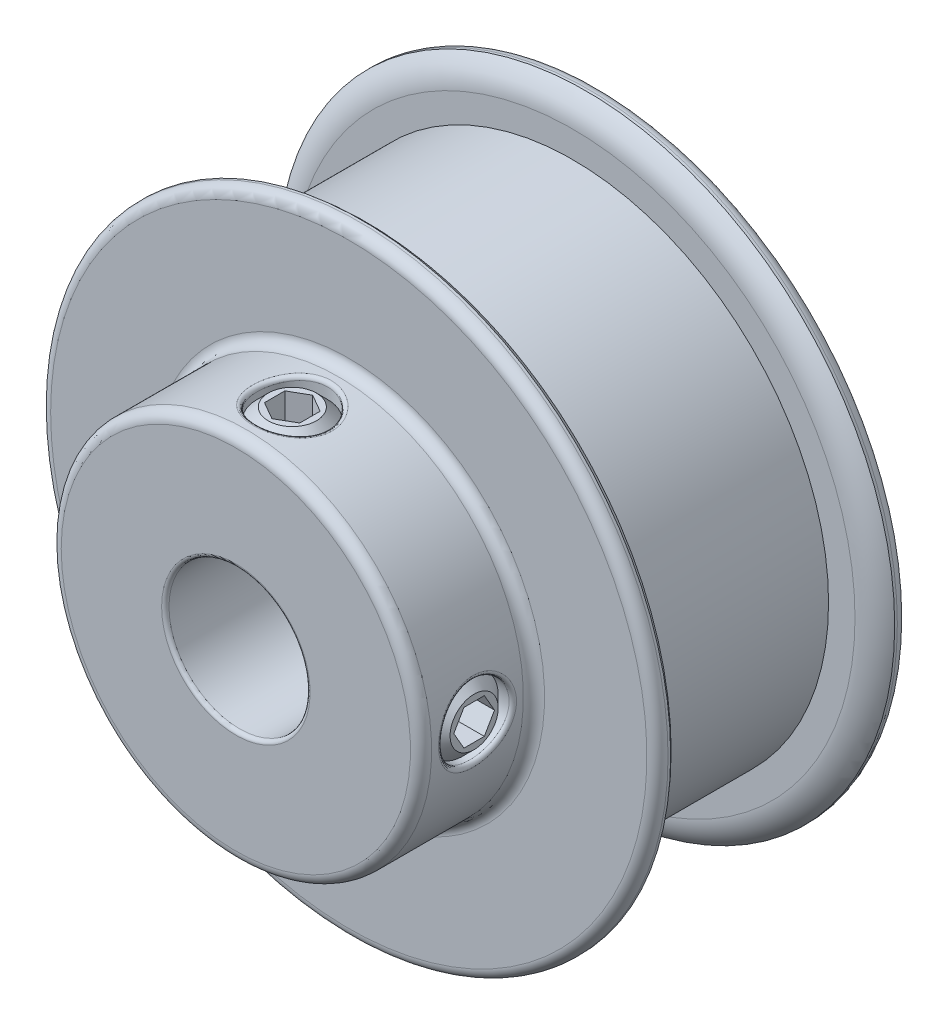
from build123d import *

# Parameters (mm, degrees)
SKETCH4_R          = 2
CUT_EXTRUDE2_DEPTH = 27.806529055
CUT_EXTRUDE3_DEPTH = 1.5
CIRPATTERN2_COUNT  = 2
CIRPATTERN2_ANGLE  = 90
FILLET1_R          = 0.6
FILLET2_R          = 0.21


with BuildPart() as part:
    # Sketch7 → Revolve1 (revolve)
    with BuildSketch(Plane(origin=(0, 0, 0), x_dir=(0, 0, -1), z_dir=(1, 0, 0)), mode=Mode.PRIVATE) as revolve1_sk:
        with BuildLine():
            Line((-10.3, 4), (-10.3, 10.5))
            Line((-10.3, 10.5), (-3.9, 10.5))
            Line((-3.9, 10.5), (-3.9, 17.5))
            Line((-3.9, 17.5), (-3.15, 17.5))
            ThreePointArc((-3.15, 17.5), (-2.597950392, 16.838586495), (-2.4, 16.000110356))
            Line((-2.4, 16.000110356), (-2.4, 14.500220711))
            Line((-2.4, 14.500220711), (8.8, 14.500220711))
            Line((8.8, 14.500220711), (8.8, 16.000110356))
            ThreePointArc((8.8, 16.000110356), (8.997950392, 16.838586495), (9.55, 17.5))
            Line((9.55, 17.5), (10.3, 17.5))
            Line((10.3, 17.5), (10.3, 4))
            Line((10.3, 4), (-10.3, 4))
        make_face()
    revolve(revolve1_sk.sketch.rotate(Axis((0, 0, 10.3), (0, 0, -1)), 90), axis=Axis((0, 0, 10.3), (0, 0, -1)))

    # Sketch4 → Cut-Extrude2 (cut, through all)
    with BuildSketch(Plane(origin=(0, 0, 0), x_dir=(1, 0, 0), z_dir=(0, 1, 0))):
        with Locations(Location((0, -7.1, 0), (0, 0, 90))):
            Circle(SKETCH4_R)
    cut_extrude2 = extrude(amount=CUT_EXTRUDE2_DEPTH, mode=Mode.SUBTRACT)

    # Sketch5 → Revolve2 (revolve)
    with BuildSketch(Plane.XY.offset(7.1), mode=Mode.PRIVATE) as revolve2_sk:
        Polygon((0, 10.307764064), (0, 4), (-1.365, 4), (-2, 4.635), (-2, 9.672764064), (-1.365, 10.307764064), align=None)
    revolve2 = revolve(revolve2_sk.sketch.rotate(Axis((0, 0, 7.1), (0, 1, 0)), 270), axis=Axis((0, 0, 7.1), (0, 1, 0)))

    # Sketch6 → Cut-Extrude3 (cut)
    with BuildSketch(Plane(origin=(0, 10.307764064, 0), x_dir=(-1, 0, 0), z_dir=(0, -1, 0))):
        Polygon((0, -5.945299462), (-1, -6.522649731), (-1, -7.677350269), (0, -8.254700538), (1, -7.677350269), (1, -6.522649731), align=None)
    cut_extrude3 = extrude(amount=CUT_EXTRUDE3_DEPTH, mode=Mode.SUBTRACT)

    # CirPattern2: Cut-Extrude2, Revolve2, Cut-Extrude3 ×2 about axis
    cirpattern2_axis = Axis((0, 0, 0), (0, 0, -1))
    add([cut_extrude2.rotate(cirpattern2_axis, i * CIRPATTERN2_ANGLE / (CIRPATTERN2_COUNT - 1)) for i in range(1, CIRPATTERN2_COUNT)], mode=Mode.SUBTRACT)
    add([revolve2.rotate(cirpattern2_axis, i * CIRPATTERN2_ANGLE / (CIRPATTERN2_COUNT - 1)) for i in range(1, CIRPATTERN2_COUNT)])
    add([cut_extrude3.rotate(cirpattern2_axis, i * CIRPATTERN2_ANGLE / (CIRPATTERN2_COUNT - 1)) for i in range(1, CIRPATTERN2_COUNT)], mode=Mode.SUBTRACT)

    # Fillet1
    fillet1_edges = [part.edges().sort_by_distance(p)[0] for p in [
        (-17.5, 0, -10.3),
        (-10.5, 0, 10.3),
        (-10.5, 0, 3.9),
        (-17.5, 0, 3.9),
    ]]
    fillet(fillet1_edges, radius=FILLET1_R)

    # Fillet2
    fillet2_edges = [part.edges().sort_by_distance(p)[0] for p in [
        (-4, 0, -10.3),
        (0, 10.499999999, 9.100000012),
        (10.307764064, -2, 7.1),
        (-4, 0, 10.3),
    ]]
    fillet(fillet2_edges, radius=FILLET2_R)


solid = part.part
